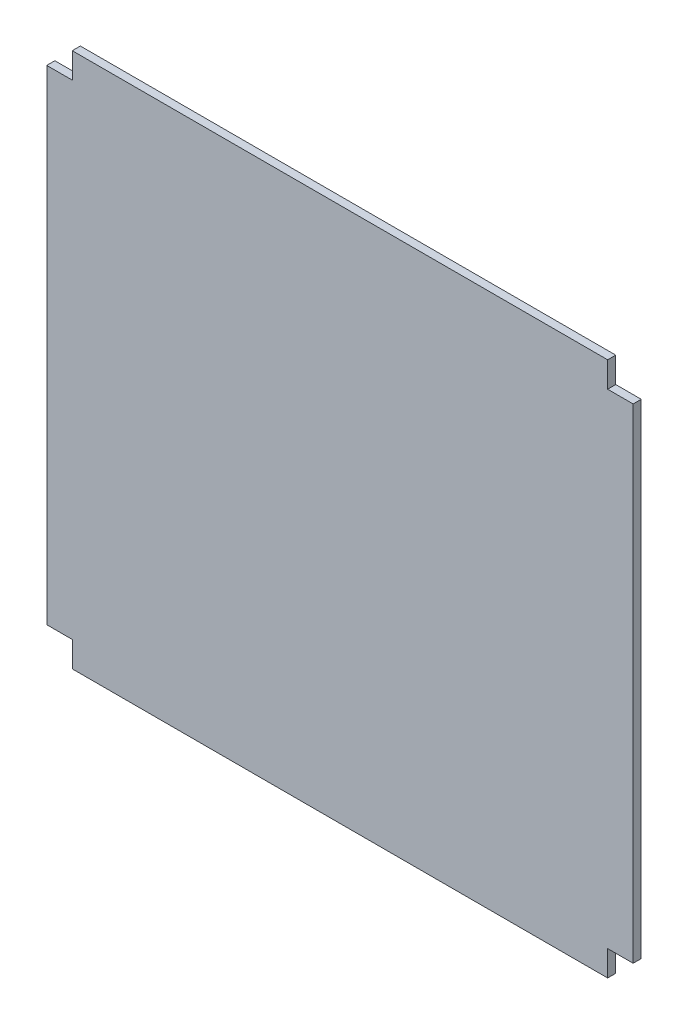
from build123d import *

# Parameters (mm, degrees)
SKETCH1_W           = 920
SKETCH1_H           = 840
BOSS_EXTRUDE1_DEPTH = 12.7
SKETCH2_W           = 40
SKETCH2_H           = 40
CUT_EXTRUDE1_DEPTH  = 12.7


with BuildPart() as part:
    # Sketch1 → Boss-Extrude1 (new body)
    with BuildSketch(Plane.XY):
        Rectangle(SKETCH1_W, SKETCH1_H)
    extrude(amount=BOSS_EXTRUDE1_DEPTH)

    # Sketch2 → Cut-Extrude1 (cut)
    with BuildSketch(Plane.XY.offset(12.7)):
        with Locations((-440, 400)):
            Rectangle(SKETCH2_W, SKETCH2_H)
        with Locations((440, -400)):
            Rectangle(SKETCH2_W, SKETCH2_H)
        with Locations((440, 400)):
            Rectangle(SKETCH2_W, SKETCH2_H)
        with Locations((-440, -400)):
            Rectangle(SKETCH2_W, SKETCH2_H)
    extrude(amount=-CUT_EXTRUDE1_DEPTH, mode=Mode.SUBTRACT)


solid = part.part
